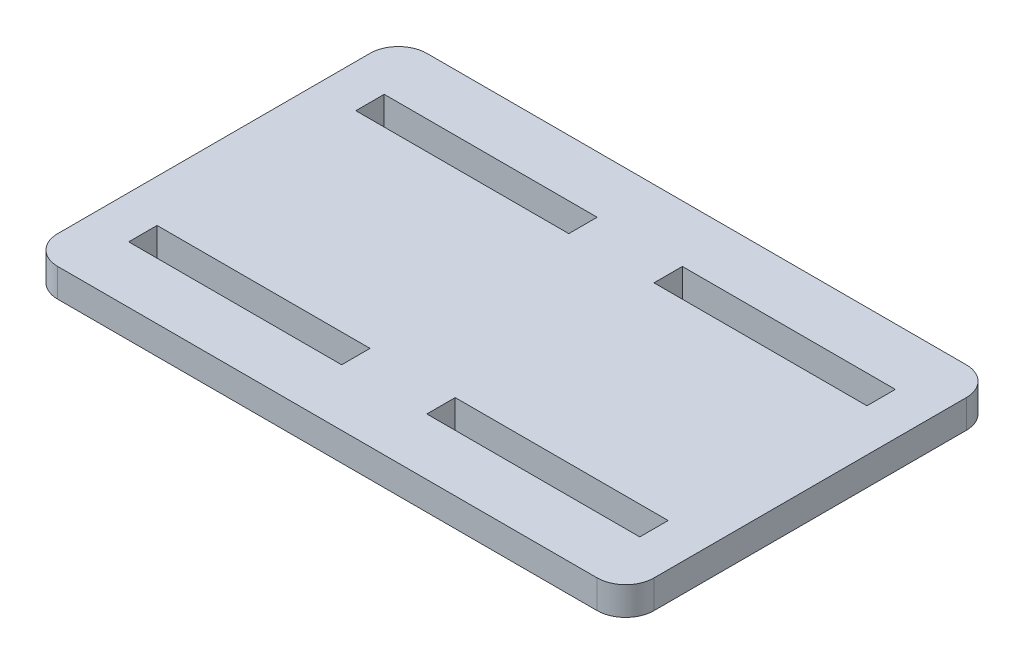
from build123d import *

# Parameters (mm, degrees)
SKETCH1_W               = 17.78
SKETCH1_H               = 2.54
BOSS_EXTRUDE1_DEPTH     = 11.43
SKETCH2_W               = 17.78
SKETCH2_H               = 2.54
BOSS_EXTRUDE2_DEPTH     = 15.24
SKETCH16_W              = 3.81
SKETCH16_H              = 2.54
BOSS_EXTRUDE10_DEPTH    = 7.62
BOSS_EXTRUDE11_REACH    = 36.757
SKETCH17_W              = 5.08
SKETCH17_H              = 2.54
MIRROR3_COPY_1_SKETCH_W = 3.81
MIRROR3_COPY_1_SKETCH_H = 2.54
MIRROR3_COPY_1_DEPTH    = 7.62
MIRROR3_COPY_2_REACH    = 36.757
MIRROR3_COPY_2_SKETCH_W = 5.08
MIRROR3_COPY_2_SKETCH_H = 2.54
SKETCH18_W              = 5.08
SKETCH18_H              = 17.78
BOSS_EXTRUDE12_DEPTH    = 5.08
SKETCH19_W              = 17.78
SKETCH19_H              = 2.54
BOSS_EXTRUDE13_DEPTH    = 5.08
FILLET1_R               = 2.54


with BuildPart() as part:
    # Sketch1 → Boss-Extrude1 (new body)
    with BuildSketch(Plane(origin=(0, 0, 0), x_dir=(0, 0, -1), z_dir=(1, 0, 0))):
        with Locations((0, 1.27)):
            Rectangle(SKETCH1_W, SKETCH1_H)
    extrude(amount=BOSS_EXTRUDE1_DEPTH)

    # Sketch2 → Boss-Extrude2 (add)
    with BuildSketch(Plane.ZY):
        with Locations((0, 1.27)):
            Rectangle(SKETCH2_W, SKETCH2_H)
    extrude(amount=BOSS_EXTRUDE2_DEPTH)

    # Mirror1: part across plane


with BuildPart() as part_1:
    add(part.part)
    add(part.part.mirror(Plane.ZY.offset(15.24)))

    # Sketch16 → Boss-Extrude10 (add)
    with BuildSketch(Plane.XY.offset(8.89)):
        with Locations((-17.145, 1.27)):
            Rectangle(SKETCH16_W, SKETCH16_H)
        with Locations((-40.005, 1.27)):
            Rectangle(SKETCH16_W, SKETCH16_H)
    boss_extrude10 = extrude(amount=BOSS_EXTRUDE10_DEPTH)

    # Sketch17 → Boss-Extrude11 (add, up to next)
    with BuildSketch(Plane.ZY.offset(19.05), mode=Mode.PRIVATE) as boss_extrude11_sk1:
        with Locations((13.97, 1.27)):
            Rectangle(SKETCH17_W, SKETCH17_H)
    boss_extrude11_tool1 = extrude(boss_extrude11_sk1.sketch, amount=BOSS_EXTRUDE11_REACH, mode=Mode.PRIVATE) - part_1.part
    boss_extrude11 = boss_extrude11_tool1.solids().sort_by_distance((-19.05, 1.27, 13.97))[0]
    add(boss_extrude11)

    # Mirror2: Boss-Extrude10, Boss-Extrude11 across plane
    add(boss_extrude10.mirror(Plane.ZY.offset(15.24)))
    add(boss_extrude11.mirror(Plane.ZY.offset(15.24)))

    # Mirror3: Boss-Extrude10, Boss-Extrude11 across plane
    add(boss_extrude10.mirror(Plane.XY))
    add(boss_extrude11.mirror(Plane.XY))

    # Mirror3 copy 1 sketch → Mirror3 copy 1 (add)
    with BuildSketch(Plane(origin=(-30.48, 0, -8.89), x_dir=(-1, 0, 0), z_dir=(0, 0, -1))):
        with Locations((-17.145, 1.27)):
            Rectangle(MIRROR3_COPY_1_SKETCH_W, MIRROR3_COPY_1_SKETCH_H)
        with Locations((-40.005, 1.27)):
            Rectangle(MIRROR3_COPY_1_SKETCH_W, MIRROR3_COPY_1_SKETCH_H)
    extrude(amount=MIRROR3_COPY_1_DEPTH)

    # Mirror3 copy 2 sketch → Mirror3 copy 2 (add, up to next)
    with BuildSketch(Plane(origin=(-11.43, 0, 0), x_dir=(0, 0, -1), z_dir=(1, 0, 0)), mode=Mode.PRIVATE) as mirror3_copy_2_sk1:
        with Locations((13.97, 1.27)):
            Rectangle(MIRROR3_COPY_2_SKETCH_W, MIRROR3_COPY_2_SKETCH_H)
    mirror3_copy_2_tool1 = extrude(mirror3_copy_2_sk1.sketch, amount=MIRROR3_COPY_2_REACH, mode=Mode.PRIVATE) - part_1.part
    add(mirror3_copy_2_tool1.solids().sort_by_distance((-11.43, 1.27, -13.97))[0])

    # Sketch18 → Boss-Extrude12 (add)
    with BuildSketch(Plane.XZ):
        with Locations((-2.54, 0)):
            Rectangle(SKETCH18_W, SKETCH18_H)
    boss_extrude12 = extrude(amount=BOSS_EXTRUDE12_DEPTH)

    # Sketch19 → Boss-Extrude13 (add)
    with BuildSketch(Plane.ZY.offset(5.08)):
        with Locations((0, -3.81)):
            Rectangle(SKETCH19_W, SKETCH19_H)
    boss_extrude13 = extrude(amount=BOSS_EXTRUDE13_DEPTH)

    # Mirror4: Boss-Extrude12, Boss-Extrude13 across plane
    add(boss_extrude12.mirror(Plane.ZY.offset(15.24)))
    add(boss_extrude13.mirror(Plane.ZY.offset(15.24)))

    # Fillet1
    fillet1_edges = [part_1.edges().sort_by_distance(p)[0] for p in [
        (-41.91, 1.27, -16.51),
        (11.43, 1.27, -16.51),
        (-41.91, 1.27, 16.51),
        (11.43, 1.27, 16.51),
    ]]
    fillet(fillet1_edges, radius=FILLET1_R)


solid = part_1.part
